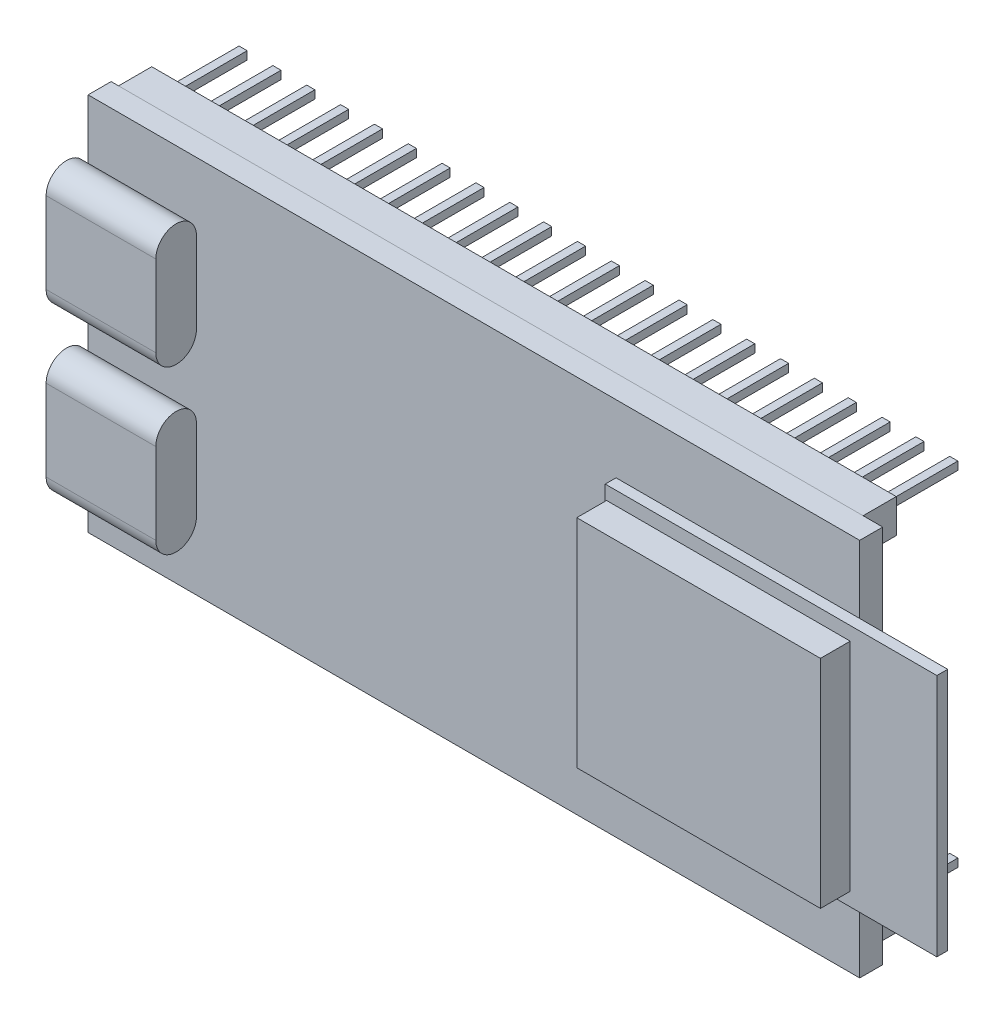
from build123d import *

# Parameters (mm, degrees)
SKETCH1_W                = 57
SKETCH1_H                = 28
BOSS_EXTRUDE1_DEPTH      = 1.7
BOSS_EXTRUDE2_START      = 1.7
SKETCH1_3_W              = 18
SKETCH1_3_H              = 16
BOSS_EXTRUDE2_DEPTH      = 3
BOSS_EXTRUDE8_START      = 1.7
SKETCH1_6_W              = 24.5
SKETCH1_6_H              = 18
BOSS_EXTRUDE8_DEPTH      = 0.8
BOSS_EXTRUDE9_DEPTH      = 8
BOSS_EXTRUDE9_DEPTH_BACK = 0.1
BOSS_EXTRUDE9_START      = -28.5
SKETCH1_7_W              = 2.5
SKETCH1_7_H              = 2.5
BOSS_EXTRUDE10_DEPTH     = 2.5
BOSS_EXTRUDE11_START     = -2.5
SKETCH1_8_W              = 0.6
SKETCH1_8_H              = 0.6
BOSS_EXTRUDE11_DEPTH     = 5.5
LPATTERN1_COUNT          = 22
LPATTERN1_PITCH          = 2.5
MIRROR1_COPY_1_SKETCH_W  = 2.5
MIRROR1_COPY_1_SKETCH_H  = 2.5
MIRROR1_COPY_1_DEPTH     = 2.5
MIRROR1_COPY_2_SKETCH_W  = 2.5
MIRROR1_COPY_2_SKETCH_H  = 2.5
MIRROR1_COPY_2_DEPTH     = 2.5
MIRROR1_COPY_3_SKETCH_W  = 2.5
MIRROR1_COPY_3_SKETCH_H  = 2.5
MIRROR1_COPY_3_DEPTH     = 2.5
MIRROR1_COPY_4_SKETCH_W  = 2.5
MIRROR1_COPY_4_SKETCH_H  = 2.5
MIRROR1_COPY_4_DEPTH     = 2.5
MIRROR1_COPY_5_SKETCH_W  = 2.5
MIRROR1_COPY_5_SKETCH_H  = 2.5
MIRROR1_COPY_5_DEPTH     = 2.5
MIRROR1_COPY_6_SKETCH_W  = 2.5
MIRROR1_COPY_6_SKETCH_H  = 2.5
MIRROR1_COPY_6_DEPTH     = 2.5
MIRROR1_COPY_7_SKETCH_W  = 2.5
MIRROR1_COPY_7_SKETCH_H  = 2.5
MIRROR1_COPY_7_DEPTH     = 2.5
MIRROR1_COPY_8_SKETCH_W  = 2.5
MIRROR1_COPY_8_SKETCH_H  = 2.5
MIRROR1_COPY_8_DEPTH     = 2.5
MIRROR1_COPY_9_SKETCH_W  = 2.5
MIRROR1_COPY_9_SKETCH_H  = 2.5
MIRROR1_COPY_9_DEPTH     = 2.5
MIRROR1_COPY_10_SKETCH_W = 2.5
MIRROR1_COPY_10_SKETCH_H = 2.5
MIRROR1_COPY_10_DEPTH    = 2.5
MIRROR1_COPY_11_SKETCH_W = 2.5
MIRROR1_COPY_11_SKETCH_H = 2.5
MIRROR1_COPY_11_DEPTH    = 2.5
MIRROR1_COPY_12_SKETCH_W = 2.5
MIRROR1_COPY_12_SKETCH_H = 2.5
MIRROR1_COPY_12_DEPTH    = 2.5
MIRROR1_COPY_13_SKETCH_W = 2.5
MIRROR1_COPY_13_SKETCH_H = 2.5
MIRROR1_COPY_13_DEPTH    = 2.5
MIRROR1_COPY_14_SKETCH_W = 2.5
MIRROR1_COPY_14_SKETCH_H = 2.5
MIRROR1_COPY_14_DEPTH    = 2.5
MIRROR1_COPY_15_SKETCH_W = 2.5
MIRROR1_COPY_15_SKETCH_H = 2.5
MIRROR1_COPY_15_DEPTH    = 2.5
MIRROR1_COPY_16_SKETCH_W = 2.5
MIRROR1_COPY_16_SKETCH_H = 2.5
MIRROR1_COPY_16_DEPTH    = 2.5
MIRROR1_COPY_17_SKETCH_W = 2.5
MIRROR1_COPY_17_SKETCH_H = 2.5
MIRROR1_COPY_17_DEPTH    = 2.5
MIRROR1_COPY_18_SKETCH_W = 2.5
MIRROR1_COPY_18_SKETCH_H = 2.5
MIRROR1_COPY_18_DEPTH    = 2.5
MIRROR1_COPY_19_SKETCH_W = 2.5
MIRROR1_COPY_19_SKETCH_H = 2.5
MIRROR1_COPY_19_DEPTH    = 2.5
MIRROR1_COPY_20_SKETCH_W = 2.5
MIRROR1_COPY_20_SKETCH_H = 2.5
MIRROR1_COPY_20_DEPTH    = 2.5
MIRROR1_COPY_21_SKETCH_W = 2.5
MIRROR1_COPY_21_SKETCH_H = 2.5
MIRROR1_COPY_21_DEPTH    = 2.5
MIRROR1_START            = -2.5
MIRROR1_COPY_22_SKETCH_W = 0.6
MIRROR1_COPY_22_SKETCH_H = 0.6
MIRROR1_COPY_22_DEPTH    = 5.5
MIRROR1_COPY_23_SKETCH_W = 0.6
MIRROR1_COPY_23_SKETCH_H = 0.6
MIRROR1_COPY_23_DEPTH    = 5.5
MIRROR1_COPY_24_SKETCH_W = 0.6
MIRROR1_COPY_24_SKETCH_H = 0.6
MIRROR1_COPY_24_DEPTH    = 5.5
MIRROR1_COPY_25_SKETCH_W = 0.6
MIRROR1_COPY_25_SKETCH_H = 0.6
MIRROR1_COPY_25_DEPTH    = 5.5
MIRROR1_COPY_26_SKETCH_W = 0.6
MIRROR1_COPY_26_SKETCH_H = 0.6
MIRROR1_COPY_26_DEPTH    = 5.5
MIRROR1_COPY_27_SKETCH_W = 0.6
MIRROR1_COPY_27_SKETCH_H = 0.6
MIRROR1_COPY_27_DEPTH    = 5.5
MIRROR1_COPY_28_SKETCH_W = 0.6
MIRROR1_COPY_28_SKETCH_H = 0.6
MIRROR1_COPY_28_DEPTH    = 5.5
MIRROR1_COPY_29_SKETCH_W = 0.6
MIRROR1_COPY_29_SKETCH_H = 0.6
MIRROR1_COPY_29_DEPTH    = 5.5
MIRROR1_COPY_30_SKETCH_W = 0.6
MIRROR1_COPY_30_SKETCH_H = 0.6
MIRROR1_COPY_30_DEPTH    = 5.5
MIRROR1_COPY_31_SKETCH_W = 0.6
MIRROR1_COPY_31_SKETCH_H = 0.6
MIRROR1_COPY_31_DEPTH    = 5.5
MIRROR1_COPY_32_SKETCH_W = 0.6
MIRROR1_COPY_32_SKETCH_H = 0.6
MIRROR1_COPY_32_DEPTH    = 5.5
MIRROR1_COPY_33_SKETCH_W = 0.6
MIRROR1_COPY_33_SKETCH_H = 0.6
MIRROR1_COPY_33_DEPTH    = 5.5
MIRROR1_COPY_34_SKETCH_W = 0.6
MIRROR1_COPY_34_SKETCH_H = 0.6
MIRROR1_COPY_34_DEPTH    = 5.5
MIRROR1_COPY_35_SKETCH_W = 0.6
MIRROR1_COPY_35_SKETCH_H = 0.6
MIRROR1_COPY_35_DEPTH    = 5.5
MIRROR1_COPY_36_SKETCH_W = 0.6
MIRROR1_COPY_36_SKETCH_H = 0.6
MIRROR1_COPY_36_DEPTH    = 5.5
MIRROR1_COPY_37_SKETCH_W = 0.6
MIRROR1_COPY_37_SKETCH_H = 0.6
MIRROR1_COPY_37_DEPTH    = 5.5
MIRROR1_COPY_38_SKETCH_W = 0.6
MIRROR1_COPY_38_SKETCH_H = 0.6
MIRROR1_COPY_38_DEPTH    = 5.5
MIRROR1_COPY_39_SKETCH_W = 0.6
MIRROR1_COPY_39_SKETCH_H = 0.6
MIRROR1_COPY_39_DEPTH    = 5.5
MIRROR1_COPY_40_SKETCH_W = 0.6
MIRROR1_COPY_40_SKETCH_H = 0.6
MIRROR1_COPY_40_DEPTH    = 5.5
MIRROR1_COPY_41_SKETCH_W = 0.6
MIRROR1_COPY_41_SKETCH_H = 0.6
MIRROR1_COPY_41_DEPTH    = 5.5
MIRROR1_COPY_42_SKETCH_W = 0.6
MIRROR1_COPY_42_SKETCH_H = 0.6
MIRROR1_COPY_42_DEPTH    = 5.5


with BuildPart() as part:
    # Sketch1 → Boss-Extrude1 (new body)
    with BuildSketch(Plane.XY):
        Rectangle(SKETCH1_W, SKETCH1_H)
    extrude(amount=BOSS_EXTRUDE1_DEPTH)

    # Sketch1<3> → Boss-Extrude2 (add)
    with BuildSketch(Plane.XY.offset(BOSS_EXTRUDE2_START)):
        with Locations((19.6, 0)):
            Rectangle(SKETCH1_3_W, SKETCH1_3_H)
    extrude(amount=BOSS_EXTRUDE2_DEPTH)

    # Sketch1<6> → Boss-Extrude8 (add)
    with BuildSketch(Plane.XY.offset(BOSS_EXTRUDE8_START)):
        with Locations((22.75, 0)):
            Rectangle(SKETCH1_6_W, SKETCH1_6_H)
    extrude(amount=BOSS_EXTRUDE8_DEPTH)

    # Sketch2 → Boss-Extrude9 (add, two sides: drawn at the far end of the back side and taken through both)
    with BuildSketch(Plane(origin=(0, 0, 0), x_dir=(0, 0, -1), z_dir=(1, 0, 0)).offset(BOSS_EXTRUDE9_START - BOSS_EXTRUDE9_DEPTH_BACK)):
        with BuildLine():
            Line((-4.7, -9), (-4.7, -3))
            ThreePointArc((-4.7, -3), (-3.2, -1.5), (-1.7, -3))
            Line((-1.7, -3), (-1.7, -9))
            ThreePointArc((-1.7, -9), (-3.2, -10.5), (-4.7, -9))
        make_face()
        with BuildLine():
            Line((-4.7, 9), (-4.7, 3))
            ThreePointArc((-4.7, 3), (-3.2, 1.5), (-1.7, 3))
            Line((-1.7, 3), (-1.7, 9))
            ThreePointArc((-1.7, 9), (-3.2, 10.5), (-4.7, 9))
        make_face()
    extrude(amount=BOSS_EXTRUDE9_DEPTH + BOSS_EXTRUDE9_DEPTH_BACK)

    # Sketch1<7> → Boss-Extrude10 (add)
    with BuildSketch(Plane.XY):
        with Locations((-26.75, 12.7)):
            Rectangle(SKETCH1_7_W, SKETCH1_7_H)
    boss_extrude10 = extrude(amount=-BOSS_EXTRUDE10_DEPTH)

    # Sketch1<8> → Boss-Extrude11 (add)
    with BuildSketch(Plane.XY.offset(BOSS_EXTRUDE11_START)):
        with Locations((-26.75, 12.7)):
            Rectangle(SKETCH1_8_W, SKETCH1_8_H)
    boss_extrude11 = extrude(amount=-BOSS_EXTRUDE11_DEPTH)

    # LPattern1: Boss-Extrude10, Boss-Extrude11 ×22
    with Locations(*[(i * LPATTERN1_PITCH, 0, 0) for i in range(1, LPATTERN1_COUNT)]):
        add(boss_extrude10)
        add(boss_extrude11)

    # Mirror1: Boss-Extrude10, Boss-Extrude11 across plane
    add(boss_extrude10.mirror(Plane.ZX))
    add(boss_extrude11.mirror(Plane.ZX))

    # Mirror1 copy 1 sketch → Mirror1 copy 1 (add)
    with BuildSketch(Plane(origin=(2.5, 0, 0), x_dir=(1, 0, 0), z_dir=(0, 0, 1))):
        with Locations((-26.75, -12.7)):
            Rectangle(MIRROR1_COPY_1_SKETCH_W, MIRROR1_COPY_1_SKETCH_H)
    extrude(amount=-MIRROR1_COPY_1_DEPTH)

    # Mirror1 copy 2 sketch → Mirror1 copy 2 (add)
    with BuildSketch(Plane(origin=(5, 0, 0), x_dir=(1, 0, 0), z_dir=(0, 0, 1))):
        with Locations((-26.75, -12.7)):
            Rectangle(MIRROR1_COPY_2_SKETCH_W, MIRROR1_COPY_2_SKETCH_H)
    extrude(amount=-MIRROR1_COPY_2_DEPTH)

    # Mirror1 copy 3 sketch → Mirror1 copy 3 (add)
    with BuildSketch(Plane(origin=(7.5, 0, 0), x_dir=(1, 0, 0), z_dir=(0, 0, 1))):
        with Locations((-26.75, -12.7)):
            Rectangle(MIRROR1_COPY_3_SKETCH_W, MIRROR1_COPY_3_SKETCH_H)
    extrude(amount=-MIRROR1_COPY_3_DEPTH)

    # Mirror1 copy 4 sketch → Mirror1 copy 4 (add)
    with BuildSketch(Plane(origin=(10, 0, 0), x_dir=(1, 0, 0), z_dir=(0, 0, 1))):
        with Locations((-26.75, -12.7)):
            Rectangle(MIRROR1_COPY_4_SKETCH_W, MIRROR1_COPY_4_SKETCH_H)
    extrude(amount=-MIRROR1_COPY_4_DEPTH)

    # Mirror1 copy 5 sketch → Mirror1 copy 5 (add)
    with BuildSketch(Plane(origin=(12.5, 0, 0), x_dir=(1, 0, 0), z_dir=(0, 0, 1))):
        with Locations((-26.75, -12.7)):
            Rectangle(MIRROR1_COPY_5_SKETCH_W, MIRROR1_COPY_5_SKETCH_H)
    extrude(amount=-MIRROR1_COPY_5_DEPTH)

    # Mirror1 copy 6 sketch → Mirror1 copy 6 (add)
    with BuildSketch(Plane(origin=(15, 0, 0), x_dir=(1, 0, 0), z_dir=(0, 0, 1))):
        with Locations((-26.75, -12.7)):
            Rectangle(MIRROR1_COPY_6_SKETCH_W, MIRROR1_COPY_6_SKETCH_H)
    extrude(amount=-MIRROR1_COPY_6_DEPTH)

    # Mirror1 copy 7 sketch → Mirror1 copy 7 (add)
    with BuildSketch(Plane(origin=(17.5, 0, 0), x_dir=(1, 0, 0), z_dir=(0, 0, 1))):
        with Locations((-26.75, -12.7)):
            Rectangle(MIRROR1_COPY_7_SKETCH_W, MIRROR1_COPY_7_SKETCH_H)
    extrude(amount=-MIRROR1_COPY_7_DEPTH)

    # Mirror1 copy 8 sketch → Mirror1 copy 8 (add)
    with BuildSketch(Plane(origin=(20, 0, 0), x_dir=(1, 0, 0), z_dir=(0, 0, 1))):
        with Locations((-26.75, -12.7)):
            Rectangle(MIRROR1_COPY_8_SKETCH_W, MIRROR1_COPY_8_SKETCH_H)
    extrude(amount=-MIRROR1_COPY_8_DEPTH)

    # Mirror1 copy 9 sketch → Mirror1 copy 9 (add)
    with BuildSketch(Plane(origin=(22.5, 0, 0), x_dir=(1, 0, 0), z_dir=(0, 0, 1))):
        with Locations((-26.75, -12.7)):
            Rectangle(MIRROR1_COPY_9_SKETCH_W, MIRROR1_COPY_9_SKETCH_H)
    extrude(amount=-MIRROR1_COPY_9_DEPTH)

    # Mirror1 copy 10 sketch → Mirror1 copy 10 (add)
    with BuildSketch(Plane(origin=(25, 0, 0), x_dir=(1, 0, 0), z_dir=(0, 0, 1))):
        with Locations((-26.75, -12.7)):
            Rectangle(MIRROR1_COPY_10_SKETCH_W, MIRROR1_COPY_10_SKETCH_H)
    extrude(amount=-MIRROR1_COPY_10_DEPTH)

    # Mirror1 copy 11 sketch → Mirror1 copy 11 (add)
    with BuildSketch(Plane(origin=(27.5, 0, 0), x_dir=(1, 0, 0), z_dir=(0, 0, 1))):
        with Locations((-26.75, -12.7)):
            Rectangle(MIRROR1_COPY_11_SKETCH_W, MIRROR1_COPY_11_SKETCH_H)
    extrude(amount=-MIRROR1_COPY_11_DEPTH)

    # Mirror1 copy 12 sketch → Mirror1 copy 12 (add)
    with BuildSketch(Plane(origin=(30, 0, 0), x_dir=(1, 0, 0), z_dir=(0, 0, 1))):
        with Locations((-26.75, -12.7)):
            Rectangle(MIRROR1_COPY_12_SKETCH_W, MIRROR1_COPY_12_SKETCH_H)
    extrude(amount=-MIRROR1_COPY_12_DEPTH)

    # Mirror1 copy 13 sketch → Mirror1 copy 13 (add)
    with BuildSketch(Plane(origin=(32.5, 0, 0), x_dir=(1, 0, 0), z_dir=(0, 0, 1))):
        with Locations((-26.75, -12.7)):
            Rectangle(MIRROR1_COPY_13_SKETCH_W, MIRROR1_COPY_13_SKETCH_H)
    extrude(amount=-MIRROR1_COPY_13_DEPTH)

    # Mirror1 copy 14 sketch → Mirror1 copy 14 (add)
    with BuildSketch(Plane(origin=(35, 0, 0), x_dir=(1, 0, 0), z_dir=(0, 0, 1))):
        with Locations((-26.75, -12.7)):
            Rectangle(MIRROR1_COPY_14_SKETCH_W, MIRROR1_COPY_14_SKETCH_H)
    extrude(amount=-MIRROR1_COPY_14_DEPTH)

    # Mirror1 copy 15 sketch → Mirror1 copy 15 (add)
    with BuildSketch(Plane(origin=(37.5, 0, 0), x_dir=(1, 0, 0), z_dir=(0, 0, 1))):
        with Locations((-26.75, -12.7)):
            Rectangle(MIRROR1_COPY_15_SKETCH_W, MIRROR1_COPY_15_SKETCH_H)
    extrude(amount=-MIRROR1_COPY_15_DEPTH)

    # Mirror1 copy 16 sketch → Mirror1 copy 16 (add)
    with BuildSketch(Plane(origin=(40, 0, 0), x_dir=(1, 0, 0), z_dir=(0, 0, 1))):
        with Locations((-26.75, -12.7)):
            Rectangle(MIRROR1_COPY_16_SKETCH_W, MIRROR1_COPY_16_SKETCH_H)
    extrude(amount=-MIRROR1_COPY_16_DEPTH)

    # Mirror1 copy 17 sketch → Mirror1 copy 17 (add)
    with BuildSketch(Plane(origin=(42.5, 0, 0), x_dir=(1, 0, 0), z_dir=(0, 0, 1))):
        with Locations((-26.75, -12.7)):
            Rectangle(MIRROR1_COPY_17_SKETCH_W, MIRROR1_COPY_17_SKETCH_H)
    extrude(amount=-MIRROR1_COPY_17_DEPTH)

    # Mirror1 copy 18 sketch → Mirror1 copy 18 (add)
    with BuildSketch(Plane(origin=(45, 0, 0), x_dir=(1, 0, 0), z_dir=(0, 0, 1))):
        with Locations((-26.75, -12.7)):
            Rectangle(MIRROR1_COPY_18_SKETCH_W, MIRROR1_COPY_18_SKETCH_H)
    extrude(amount=-MIRROR1_COPY_18_DEPTH)

    # Mirror1 copy 19 sketch → Mirror1 copy 19 (add)
    with BuildSketch(Plane(origin=(47.5, 0, 0), x_dir=(1, 0, 0), z_dir=(0, 0, 1))):
        with Locations((-26.75, -12.7)):
            Rectangle(MIRROR1_COPY_19_SKETCH_W, MIRROR1_COPY_19_SKETCH_H)
    extrude(amount=-MIRROR1_COPY_19_DEPTH)

    # Mirror1 copy 20 sketch → Mirror1 copy 20 (add)
    with BuildSketch(Plane(origin=(50, 0, 0), x_dir=(1, 0, 0), z_dir=(0, 0, 1))):
        with Locations((-26.75, -12.7)):
            Rectangle(MIRROR1_COPY_20_SKETCH_W, MIRROR1_COPY_20_SKETCH_H)
    extrude(amount=-MIRROR1_COPY_20_DEPTH)

    # Mirror1 copy 21 sketch → Mirror1 copy 21 (add)
    with BuildSketch(Plane(origin=(52.5, 0, 0), x_dir=(1, 0, 0), z_dir=(0, 0, 1))):
        with Locations((-26.75, -12.7)):
            Rectangle(MIRROR1_COPY_21_SKETCH_W, MIRROR1_COPY_21_SKETCH_H)
    extrude(amount=-MIRROR1_COPY_21_DEPTH)

    # Mirror1 copy 22 sketch → Mirror1 copy 22 (add)
    with BuildSketch(Plane(origin=(2.5, 0, 0), x_dir=(1, 0, 0), z_dir=(0, 0, 1)).offset(MIRROR1_START)):
        with Locations((-26.75, -12.7)):
            Rectangle(MIRROR1_COPY_22_SKETCH_W, MIRROR1_COPY_22_SKETCH_H)
    extrude(amount=-MIRROR1_COPY_22_DEPTH)

    # Mirror1 copy 23 sketch → Mirror1 copy 23 (add)
    with BuildSketch(Plane(origin=(5, 0, 0), x_dir=(1, 0, 0), z_dir=(0, 0, 1)).offset(MIRROR1_START)):
        with Locations((-26.75, -12.7)):
            Rectangle(MIRROR1_COPY_23_SKETCH_W, MIRROR1_COPY_23_SKETCH_H)
    extrude(amount=-MIRROR1_COPY_23_DEPTH)

    # Mirror1 copy 24 sketch → Mirror1 copy 24 (add)
    with BuildSketch(Plane(origin=(7.5, 0, 0), x_dir=(1, 0, 0), z_dir=(0, 0, 1)).offset(MIRROR1_START)):
        with Locations((-26.75, -12.7)):
            Rectangle(MIRROR1_COPY_24_SKETCH_W, MIRROR1_COPY_24_SKETCH_H)
    extrude(amount=-MIRROR1_COPY_24_DEPTH)

    # Mirror1 copy 25 sketch → Mirror1 copy 25 (add)
    with BuildSketch(Plane(origin=(10, 0, 0), x_dir=(1, 0, 0), z_dir=(0, 0, 1)).offset(MIRROR1_START)):
        with Locations((-26.75, -12.7)):
            Rectangle(MIRROR1_COPY_25_SKETCH_W, MIRROR1_COPY_25_SKETCH_H)
    extrude(amount=-MIRROR1_COPY_25_DEPTH)

    # Mirror1 copy 26 sketch → Mirror1 copy 26 (add)
    with BuildSketch(Plane(origin=(12.5, 0, 0), x_dir=(1, 0, 0), z_dir=(0, 0, 1)).offset(MIRROR1_START)):
        with Locations((-26.75, -12.7)):
            Rectangle(MIRROR1_COPY_26_SKETCH_W, MIRROR1_COPY_26_SKETCH_H)
    extrude(amount=-MIRROR1_COPY_26_DEPTH)

    # Mirror1 copy 27 sketch → Mirror1 copy 27 (add)
    with BuildSketch(Plane(origin=(15, 0, 0), x_dir=(1, 0, 0), z_dir=(0, 0, 1)).offset(MIRROR1_START)):
        with Locations((-26.75, -12.7)):
            Rectangle(MIRROR1_COPY_27_SKETCH_W, MIRROR1_COPY_27_SKETCH_H)
    extrude(amount=-MIRROR1_COPY_27_DEPTH)

    # Mirror1 copy 28 sketch → Mirror1 copy 28 (add)
    with BuildSketch(Plane(origin=(17.5, 0, 0), x_dir=(1, 0, 0), z_dir=(0, 0, 1)).offset(MIRROR1_START)):
        with Locations((-26.75, -12.7)):
            Rectangle(MIRROR1_COPY_28_SKETCH_W, MIRROR1_COPY_28_SKETCH_H)
    extrude(amount=-MIRROR1_COPY_28_DEPTH)

    # Mirror1 copy 29 sketch → Mirror1 copy 29 (add)
    with BuildSketch(Plane(origin=(20, 0, 0), x_dir=(1, 0, 0), z_dir=(0, 0, 1)).offset(MIRROR1_START)):
        with Locations((-26.75, -12.7)):
            Rectangle(MIRROR1_COPY_29_SKETCH_W, MIRROR1_COPY_29_SKETCH_H)
    extrude(amount=-MIRROR1_COPY_29_DEPTH)

    # Mirror1 copy 30 sketch → Mirror1 copy 30 (add)
    with BuildSketch(Plane(origin=(22.5, 0, 0), x_dir=(1, 0, 0), z_dir=(0, 0, 1)).offset(MIRROR1_START)):
        with Locations((-26.75, -12.7)):
            Rectangle(MIRROR1_COPY_30_SKETCH_W, MIRROR1_COPY_30_SKETCH_H)
    extrude(amount=-MIRROR1_COPY_30_DEPTH)

    # Mirror1 copy 31 sketch → Mirror1 copy 31 (add)
    with BuildSketch(Plane(origin=(25, 0, 0), x_dir=(1, 0, 0), z_dir=(0, 0, 1)).offset(MIRROR1_START)):
        with Locations((-26.75, -12.7)):
            Rectangle(MIRROR1_COPY_31_SKETCH_W, MIRROR1_COPY_31_SKETCH_H)
    extrude(amount=-MIRROR1_COPY_31_DEPTH)

    # Mirror1 copy 32 sketch → Mirror1 copy 32 (add)
    with BuildSketch(Plane(origin=(27.5, 0, 0), x_dir=(1, 0, 0), z_dir=(0, 0, 1)).offset(MIRROR1_START)):
        with Locations((-26.75, -12.7)):
            Rectangle(MIRROR1_COPY_32_SKETCH_W, MIRROR1_COPY_32_SKETCH_H)
    extrude(amount=-MIRROR1_COPY_32_DEPTH)

    # Mirror1 copy 33 sketch → Mirror1 copy 33 (add)
    with BuildSketch(Plane(origin=(30, 0, 0), x_dir=(1, 0, 0), z_dir=(0, 0, 1)).offset(MIRROR1_START)):
        with Locations((-26.75, -12.7)):
            Rectangle(MIRROR1_COPY_33_SKETCH_W, MIRROR1_COPY_33_SKETCH_H)
    extrude(amount=-MIRROR1_COPY_33_DEPTH)

    # Mirror1 copy 34 sketch → Mirror1 copy 34 (add)
    with BuildSketch(Plane(origin=(32.5, 0, 0), x_dir=(1, 0, 0), z_dir=(0, 0, 1)).offset(MIRROR1_START)):
        with Locations((-26.75, -12.7)):
            Rectangle(MIRROR1_COPY_34_SKETCH_W, MIRROR1_COPY_34_SKETCH_H)
    extrude(amount=-MIRROR1_COPY_34_DEPTH)

    # Mirror1 copy 35 sketch → Mirror1 copy 35 (add)
    with BuildSketch(Plane(origin=(35, 0, 0), x_dir=(1, 0, 0), z_dir=(0, 0, 1)).offset(MIRROR1_START)):
        with Locations((-26.75, -12.7)):
            Rectangle(MIRROR1_COPY_35_SKETCH_W, MIRROR1_COPY_35_SKETCH_H)
    extrude(amount=-MIRROR1_COPY_35_DEPTH)

    # Mirror1 copy 36 sketch → Mirror1 copy 36 (add)
    with BuildSketch(Plane(origin=(37.5, 0, 0), x_dir=(1, 0, 0), z_dir=(0, 0, 1)).offset(MIRROR1_START)):
        with Locations((-26.75, -12.7)):
            Rectangle(MIRROR1_COPY_36_SKETCH_W, MIRROR1_COPY_36_SKETCH_H)
    extrude(amount=-MIRROR1_COPY_36_DEPTH)

    # Mirror1 copy 37 sketch → Mirror1 copy 37 (add)
    with BuildSketch(Plane(origin=(40, 0, 0), x_dir=(1, 0, 0), z_dir=(0, 0, 1)).offset(MIRROR1_START)):
        with Locations((-26.75, -12.7)):
            Rectangle(MIRROR1_COPY_37_SKETCH_W, MIRROR1_COPY_37_SKETCH_H)
    extrude(amount=-MIRROR1_COPY_37_DEPTH)

    # Mirror1 copy 38 sketch → Mirror1 copy 38 (add)
    with BuildSketch(Plane(origin=(42.5, 0, 0), x_dir=(1, 0, 0), z_dir=(0, 0, 1)).offset(MIRROR1_START)):
        with Locations((-26.75, -12.7)):
            Rectangle(MIRROR1_COPY_38_SKETCH_W, MIRROR1_COPY_38_SKETCH_H)
    extrude(amount=-MIRROR1_COPY_38_DEPTH)

    # Mirror1 copy 39 sketch → Mirror1 copy 39 (add)
    with BuildSketch(Plane(origin=(45, 0, 0), x_dir=(1, 0, 0), z_dir=(0, 0, 1)).offset(MIRROR1_START)):
        with Locations((-26.75, -12.7)):
            Rectangle(MIRROR1_COPY_39_SKETCH_W, MIRROR1_COPY_39_SKETCH_H)
    extrude(amount=-MIRROR1_COPY_39_DEPTH)

    # Mirror1 copy 40 sketch → Mirror1 copy 40 (add)
    with BuildSketch(Plane(origin=(47.5, 0, 0), x_dir=(1, 0, 0), z_dir=(0, 0, 1)).offset(MIRROR1_START)):
        with Locations((-26.75, -12.7)):
            Rectangle(MIRROR1_COPY_40_SKETCH_W, MIRROR1_COPY_40_SKETCH_H)
    extrude(amount=-MIRROR1_COPY_40_DEPTH)

    # Mirror1 copy 41 sketch → Mirror1 copy 41 (add)
    with BuildSketch(Plane(origin=(50, 0, 0), x_dir=(1, 0, 0), z_dir=(0, 0, 1)).offset(MIRROR1_START)):
        with Locations((-26.75, -12.7)):
            Rectangle(MIRROR1_COPY_41_SKETCH_W, MIRROR1_COPY_41_SKETCH_H)
    extrude(amount=-MIRROR1_COPY_41_DEPTH)

    # Mirror1 copy 42 sketch → Mirror1 copy 42 (add)
    with BuildSketch(Plane(origin=(52.5, 0, 0), x_dir=(1, 0, 0), z_dir=(0, 0, 1)).offset(MIRROR1_START)):
        with Locations((-26.75, -12.7)):
            Rectangle(MIRROR1_COPY_42_SKETCH_W, MIRROR1_COPY_42_SKETCH_H)
    extrude(amount=-MIRROR1_COPY_42_DEPTH)


solid = part.part
